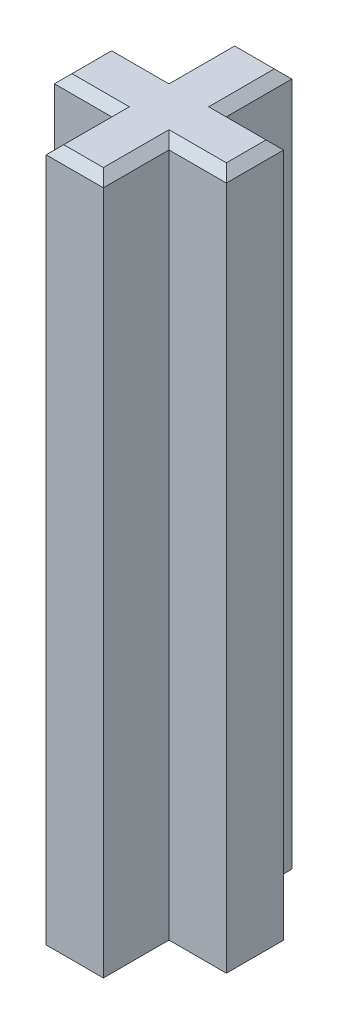
from build123d import *

# Parameters (mm, degrees)
SKETCH1_W           = 1.635
SKETCH1_H           = 1.63
SKETCH1_W_2         = 1.63
SKETCH1_H_2         = 1.87
BOSS_EXTRUDE1_DEPTH = 20
CHAMFER1_SIZE       = 0.25
CHAMFER2_SIZE       = 0.25


with BuildPart() as part:
    # Sketch1 → Boss-Extrude1 (new body)
    with BuildSketch(Plane(origin=(0, 0, 0), x_dir=(1, 0, 0), z_dir=(0, 1, 0))):
        with Locations((-0.8175, 2.685)):
            Rectangle(SKETCH1_W, SKETCH1_H)
        with Locations((0.815, 2.685)):
            Rectangle(SKETCH1_W_2, SKETCH1_H)
        with Locations((0.815, 4.435)):
            Rectangle(SKETCH1_W_2, SKETCH1_H_2)
        with Locations((2.4475, 2.685)):
            Rectangle(SKETCH1_W, SKETCH1_H)
        with Locations((0.815, 0.935)):
            Rectangle(SKETCH1_W_2, SKETCH1_H_2)
    extrude(amount=BOSS_EXTRUDE1_DEPTH)

    # Chamfer1
    chamfer1_edges = [part.edges().sort_by_distance(p)[0] for p in [
        (-0.8175, 20, -1.87),
        (0, 20, -0.935),
        (0.815, 20, 0),
        (1.63, 20, -0.935),
        (2.4475, 20, -1.87),
        (3.265, 20, -2.685),
        (2.4475, 20, -3.5),
        (1.63, 20, -4.435),
        (-1.635, 20, -2.685),
        (0.815, 20, -5.37),
        (0, 20, -4.435),
        (-0.8175, 20, -3.5),
    ]]
    chamfer(chamfer1_edges, length=CHAMFER1_SIZE)

    # Chamfer2
    chamfer2_edges = [part.edges().sort_by_distance(p)[0] for p in [
        (-0.8175, 0, -3.5),
        (0, 0, -4.435),
        (0.815, 0, -5.37),
        (1.63, 0, -4.435),
        (2.4475, 0, -3.5),
        (3.265, 0, -2.685),
        (2.4475, 0, -1.87),
        (1.63, 0, -0.935),
        (0.815, 0, 0),
        (0, 0, -0.935),
        (-0.8175, 0, -1.87),
        (-1.635, 0, -2.685),
    ]]
    chamfer(chamfer2_edges, length=CHAMFER2_SIZE)


solid = part.part
